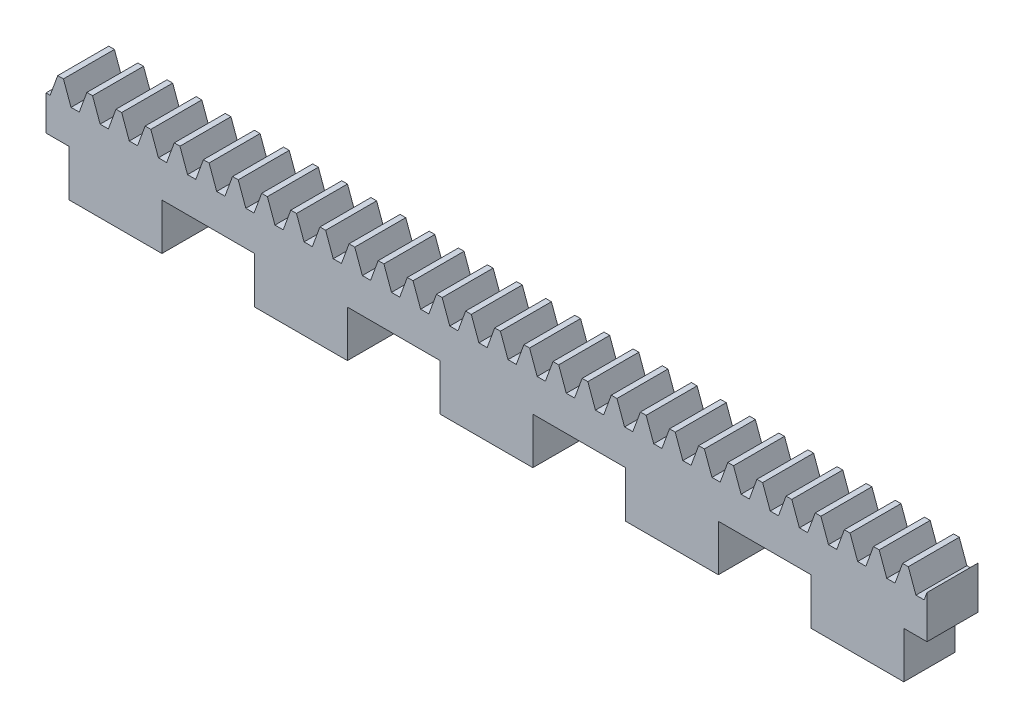
from build123d import *

# Parameters (mm, degrees)
BLANKSKE_W          = 95
BLANKSKE_H          = 11
BLANK_DEPTH         = 5.5
TOOTHCUTSIM_DEPTH   = 96.792745028
TEETHCUTS_COUNT     = 31
TEETHCUTS_PITCH     = 3.14159265
SKETCH_1_W          = 10
SKETCH_1_H          = 5
CUT_EXTRUDE_1_DEPTH = 96.792745028


with BuildPart() as part:
    # BlankSke → Blank (new body)
    with BuildSketch(Plane.XY):
        with Locations((47.5, 5.5)):
            Rectangle(BLANKSKE_W, BLANKSKE_H)
    extrude(amount=-BLANK_DEPTH)

    # TooCutSkeSim → ToothCutSim (cut, through all)
    with BuildSketch(Plane.XY):
        Polygon((0.44443537, 8.75), (-0.44443537, 8.75), (-1.272613241, 11.0254), (1.272613241, 11.0254), align=None)
    toothcutsim = extrude(amount=-TOOTHCUTSIM_DEPTH, mode=Mode.SUBTRACT)

    # TeethCuts: ToothCutSim ×31
    with Locations(*[(i * TEETHCUTS_PITCH, 0, 0) for i in range(1, TEETHCUTS_COUNT)]):
        add(toothcutsim, mode=Mode.SUBTRACT)

    # ｽｹｯﾁ1 → ｶｯﾄ - 押し出し1 (cut, through all)
    with BuildSketch(Plane.XY):
        with Locations((-2.5, 2.5)):
            Rectangle(SKETCH_1_W, SKETCH_1_H)
        with Locations((17.5, 2.5)):
            Rectangle(SKETCH_1_W, SKETCH_1_H)
        with Locations((37.5, 2.5)):
            Rectangle(SKETCH_1_W, SKETCH_1_H)
        with Locations((57.5, 2.5)):
            Rectangle(SKETCH_1_W, SKETCH_1_H)
        with Locations((77.5, 2.5)):
            Rectangle(SKETCH_1_W, SKETCH_1_H)
        with Locations((97.5, 2.5)):
            Rectangle(SKETCH_1_W, SKETCH_1_H)
    extrude(amount=-CUT_EXTRUDE_1_DEPTH, mode=Mode.SUBTRACT)


solid = part.part
